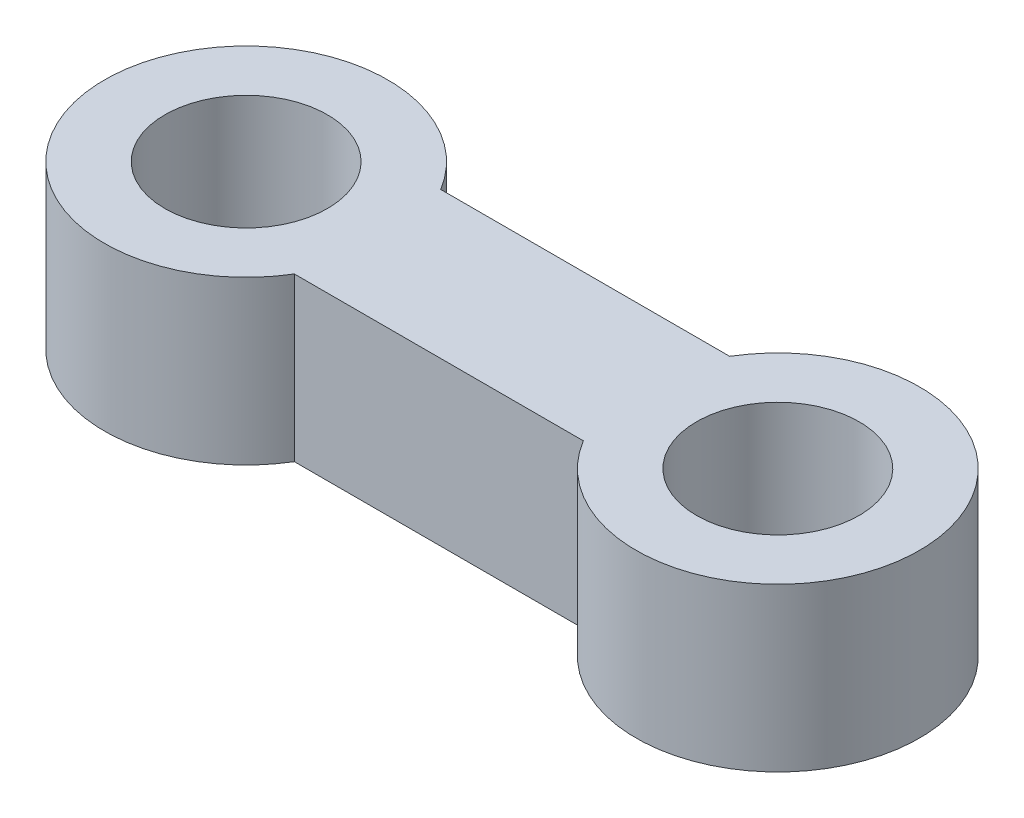
from build123d import *
from build123d.topology import SkipClean

# Parameters (mm, degrees)
BOSS_EXTRUDE1_DEPTH = 3
SKETCH2_R           = 1.5
CUT_EXTRUDE1_DEPTH  = 9.507546276
CUT_EXTRUDE2_DEPTH  = 9.507546276


with BuildPart() as part:
    # Sketch1 → Boss-Extrude1 (new body)
    with BuildSketch(Plane(origin=(0, 0, 0), x_dir=(1, 0, 0), z_dir=(0, 1, 0))):
        with BuildLine():
            Line((-4.905, 2.614492754), (4.905, 2.614492754))
            ThreePointArc((4.905, 2.614492754), (7.519492754, 0), (4.905, -2.614492754))
            Line((4.905, -2.614492754), (-4.905, -2.614492754))
            ThreePointArc((-4.905, -2.614492754), (-7.519492754, 0), (-4.905, 2.614492754))
        make_face()
    extrude(amount=BOSS_EXTRUDE1_DEPTH)

    # Sketch2 → Cut-Extrude1 (cut, through all)
    with BuildSketch(Plane(origin=(0, 3, 0), x_dir=(1, 0, 0), z_dir=(0, 1, 0))):
        with Locations(Location((-4.905, 0, 0), (0, 0, 270))):
            Circle(SKETCH2_R)
        with Locations(Location((4.905, 0, 0), (0, 0, 270))):
            Circle(SKETCH2_R)
    extrude(amount=-CUT_EXTRUDE1_DEPTH, mode=Mode.SUBTRACT)

    # Sketch3 → Cut-Extrude2 (cut, through all)
    with SkipClean():  # the faces are left unmerged after this step: merging them gives an invalid solid
        with BuildSketch(Plane(origin=(0, 3, 0), x_dir=(1, 0, 0), z_dir=(0, 1, 0))):
            with BuildLine():
                Line((-2.666010862, 1.35), (2.666010862, 1.35))
                ThreePointArc((2.666010862, 1.35), (3.619308135, 2.276525596), (4.905, 2.614492754))
                Line((4.905, 2.614492754), (-4.905, 2.614492754))
                ThreePointArc((-4.905, 2.614492754), (-3.619308135, 2.276525596), (-2.666010862, 1.35))
            make_face()
            with BuildLine():
                Line((-2.666010862, -1.35), (2.666010862, -1.35))
                ThreePointArc((2.666010862, -1.35), (3.619308135, -2.276525596), (4.905, -2.614492754))
                Line((4.905, -2.614492754), (-4.905, -2.614492754))
                ThreePointArc((-4.905, -2.614492754), (-3.619308135, -2.276525596), (-2.666010862, -1.35))
            make_face()
        extrude(amount=-CUT_EXTRUDE2_DEPTH, mode=Mode.SUBTRACT)


solid = part.part
